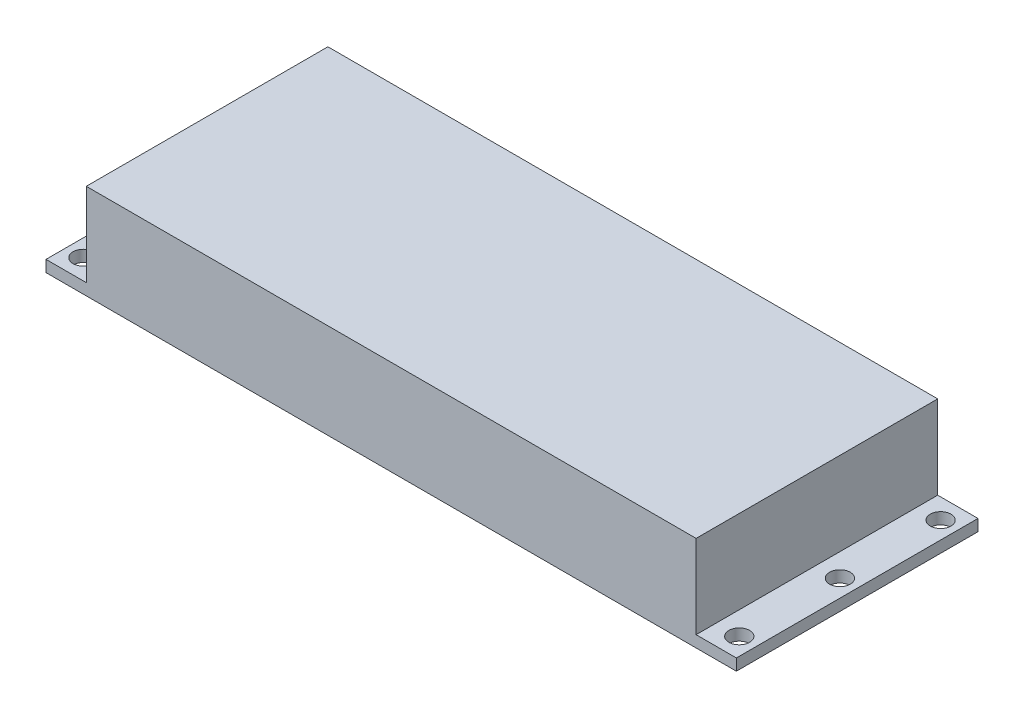
from build123d import *

# Parameters (mm, degrees)
SKETCH_1_W                  = 120
SKETCH_1_H                  = 42
EXTRUDE_1_DEPTH             = 2
SKETCH_2_W                  = 106
SKETCH_2_H                  = 42
EXTRUDE_2_DEPTH             = 14.5
HOLE_WIZARD_M3_1_AT_2_COUNT = 2
HOLE_WIZARD_M3_1_AT_2_PITCH = 17.5


with BuildPart() as part:
    # ｽｹｯﾁ1 → ﾎﾞｽ - 押し出し1 (new body)
    with BuildSketch(Plane(origin=(0, 0, 0), x_dir=(1, 0, 0), z_dir=(0, 1, 0))):
        Rectangle(SKETCH_1_W, SKETCH_1_H)
    extrude(amount=EXTRUDE_1_DEPTH)

    # ｽｹｯﾁ2 → ﾎﾞｽ - 押し出し2 (add)
    with BuildSketch(Plane(origin=(0, 2, 0), x_dir=(1, 0, 0), z_dir=(0, 1, 0))):
        Rectangle(SKETCH_2_W, SKETCH_2_H)
    extrude(amount=EXTRUDE_2_DEPTH)

    # ｽｹｯﾁ4 → M3 すきま穴1 (revolve, cut)
    with BuildSketch(Plane(origin=(-57, 2, -17.5), x_dir=(0, 0, 1), z_dir=(1, 0, 0))):
        Polygon((0, 0), (0, 6.081549114), (1.8, 5), (1.8, 0), align=None)
    hole_wizard_m3_1 = revolve(axis=Axis((-57, 8.35, -17.5), (0, -1, 0)), mode=Mode.SUBTRACT)

    # M3 すきま穴1 at 2: M3 すきま穴1 ×2
    with Locations(*[(0, 0, i * HOLE_WIZARD_M3_1_AT_2_PITCH) for i in range(1, HOLE_WIZARD_M3_1_AT_2_COUNT)]):
        add(hole_wizard_m3_1, mode=Mode.SUBTRACT)

    # ﾐﾗｰ1: M3 すきま穴1 across plane
    add(hole_wizard_m3_1.mirror(Plane.XY), mode=Mode.SUBTRACT)

    # ﾐﾗｰ1 copy 1 sketch → ﾐﾗｰ1 copy 1 (revolve, cut)
    with BuildSketch(Plane(origin=(-57, 2, 0), x_dir=(0, 0, -1), z_dir=(1, 0, 0))):
        Polygon((0, 0), (0, -6.081549114), (1.8, -5), (1.8, 0), align=None)
    revolve(axis=Axis((-57, 8.35, 0), (0, 1, 0)), mode=Mode.SUBTRACT)

    # ﾐﾗｰ2: M3 すきま穴1 across plane
    add(hole_wizard_m3_1.mirror(Plane(origin=(0, 0, 0), x_dir=(0, 0, 1), z_dir=(1, 0, 0))), mode=Mode.SUBTRACT)

    # ﾐﾗｰ2 copy 1 sketch → ﾐﾗｰ2 copy 1 (revolve, cut)
    with BuildSketch(Plane(origin=(57, 2, 0), x_dir=(0, 0, 1), z_dir=(-1, 0, 0))):
        Polygon((0, 0), (0, -6.081549114), (1.8, -5), (1.8, 0), align=None)
    revolve(axis=Axis((57, 8.35, 0), (0, 1, 0)), mode=Mode.SUBTRACT)

    # ﾐﾗｰ2 copy 2 sketch → ﾐﾗｰ2 copy 2 (revolve, cut)
    with BuildSketch(Plane(origin=(57, 2, 17.5), x_dir=(0, 0, -1), z_dir=(-1, 0, 0))):
        Polygon((0, 0), (0, 6.081549114), (1.8, 5), (1.8, 0), align=None)
    revolve(axis=Axis((57, 8.35, 17.5), (0, -1, 0)), mode=Mode.SUBTRACT)

    # ﾐﾗｰ2 copy 3 sketch → ﾐﾗｰ2 copy 3 (revolve, cut)
    with BuildSketch(Plane(origin=(57, 2, 0), x_dir=(0, 0, -1), z_dir=(-1, 0, 0))):
        Polygon((0, 0), (0, 6.081549114), (1.8, 5), (1.8, 0), align=None)
    revolve(axis=Axis((57, 8.35, 0), (0, -1, 0)), mode=Mode.SUBTRACT)


solid = part.part
